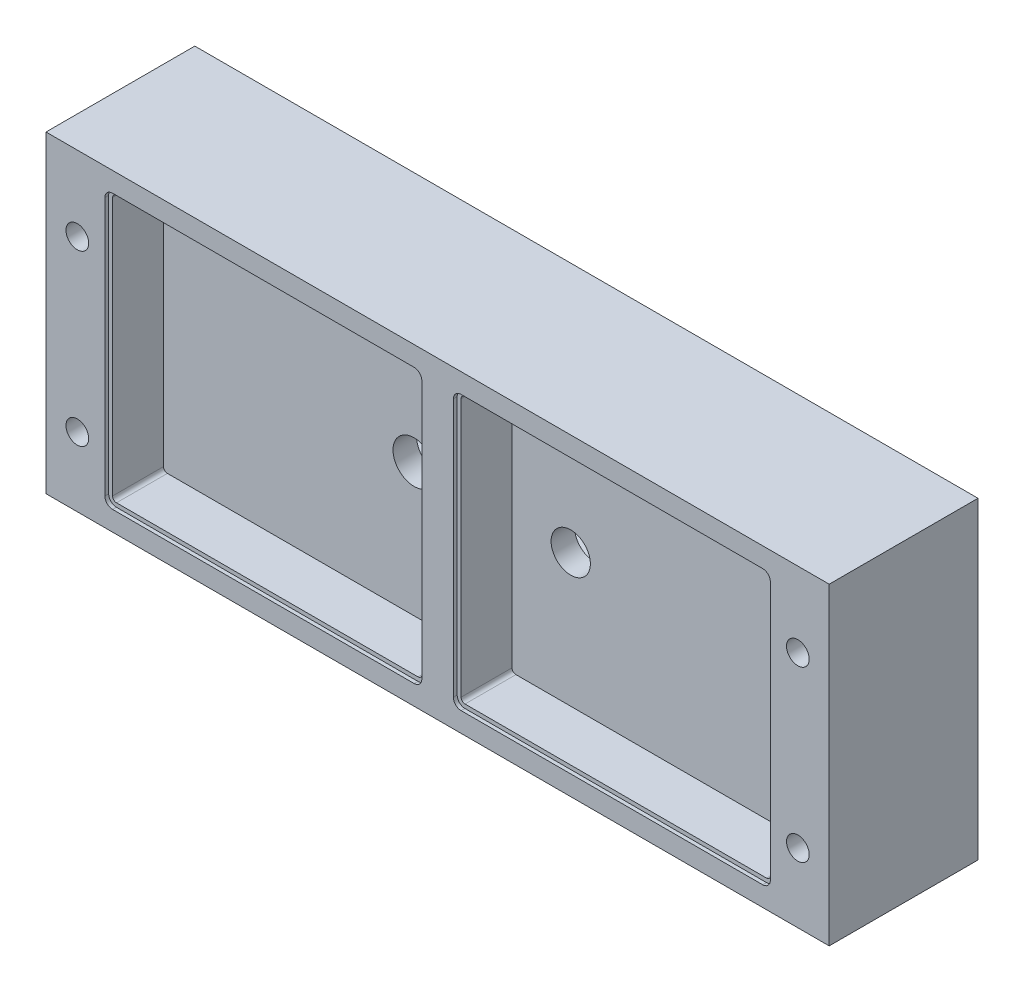
from build123d import *

# Parameters (mm, degrees)
SKETCH1_W           = 100
SKETCH1_H           = 40
BOSS_EXTRUDE1_DEPTH = 38
CUT_EXTRUDE2_START  = -12
SKETCH2_W           = 39.5
SKETCH2_H           = 34
CUT_EXTRUDE2_DEPTH  = 21
CUT_EXTRUDE4_REACH  = 81.36
SKETCH4_R           = 1.45
SKETCH6_W           = 100
SKETCH6_H           = 19
CUT_EXTRUDE5_DEPTH  = 87.215210375
FILLET1_R           = 0.5
CUT_EXTRUDE6_START  = 6.5
CUT_EXTRUDE6_DEPTH  = 0.5
CUT_EXTRUDE6_TAPER  = 2
CUT_EXTRUDE7_START  = 6.5
CUT_EXTRUDE7_DEPTH  = 0.5
CUT_EXTRUDE7_TAPER  = 2
CUT_EXTRUDE12_DEPTH = 9
CUT_EXTRUDE13_REACH = 72.385
SKETCH18_R          = 2.506862912
SKETCH18_R_2        = 2.693115416
SKETCH19_R          = 6.477
SKETCH19_R_2        = 4.572
CUT_EXTRUDE14_DEPTH = 0.79375


with BuildPart() as part:
    # Sketch1 → Boss-Extrude1 (new body)
    with BuildSketch(Plane.XY):
        with Locations((16.25, 1.5625)):
            Rectangle(SKETCH1_W, SKETCH1_H)
    extrude(amount=BOSS_EXTRUDE1_DEPTH)

    # Sketch2 → Cut-Extrude2 (cut)
    with BuildSketch(Plane(origin=(0, 0, 0), x_dir=(-1, 0, 0), z_dir=(0, 0, -1)).offset(CUT_EXTRUDE2_START)):
        with Locations((-38.5, 1.5625)):
            Rectangle(SKETCH2_W, SKETCH2_H)
        with Locations((6, 1.5625)):
            Rectangle(SKETCH2_W, SKETCH2_H)
    extrude(amount=-CUT_EXTRUDE2_DEPTH, mode=Mode.SUBTRACT)

    # Sketch4 → Cut-Extrude4 (cut, up to next)
    with BuildSketch(Plane(origin=(0, 0, 0), x_dir=(-1, 0, 0), z_dir=(0, 0, -1)), mode=Mode.PRIVATE) as cut_extrude4_sk1:
        with Locations((-62.25, 11.98479819)):
            Circle(SKETCH4_R)
    cut_extrude4_tool1 = extrude(cut_extrude4_sk1.sketch, amount=-CUT_EXTRUDE4_REACH, mode=Mode.PRIVATE) & part.part
    # Sketch4 → Cut-Extrude4 (cut, up to next)
    with BuildSketch(Plane(origin=(0, 0, 0), x_dir=(-1, 0, 0), z_dir=(0, 0, -1)), mode=Mode.PRIVATE) as cut_extrude4_sk2:
        with Locations((-62.25, -9.616561755)):
            Circle(SKETCH4_R)
    cut_extrude4_tool2 = extrude(cut_extrude4_sk2.sketch, amount=-CUT_EXTRUDE4_REACH, mode=Mode.PRIVATE) & part.part
    # Sketch4 → Cut-Extrude4 (cut, up to next)
    with BuildSketch(Plane(origin=(0, 0, 0), x_dir=(-1, 0, 0), z_dir=(0, 0, -1)), mode=Mode.PRIVATE) as cut_extrude4_sk3:
        with Locations((29.75, 11.98479819)):
            Circle(SKETCH4_R)
    cut_extrude4_tool3 = extrude(cut_extrude4_sk3.sketch, amount=-CUT_EXTRUDE4_REACH, mode=Mode.PRIVATE) & part.part
    # Sketch4 → Cut-Extrude4 (cut, up to next)
    with BuildSketch(Plane(origin=(0, 0, 0), x_dir=(-1, 0, 0), z_dir=(0, 0, -1)), mode=Mode.PRIVATE) as cut_extrude4_sk4:
        with Locations((29.75, -9.616561755)):
            Circle(SKETCH4_R)
    cut_extrude4_tool4 = extrude(cut_extrude4_sk4.sketch, amount=-CUT_EXTRUDE4_REACH, mode=Mode.PRIVATE) & part.part
    add(cut_extrude4_tool1.solids().sort_by_distance((62.25, 11.984798, 0))[0], mode=Mode.SUBTRACT)
    add(cut_extrude4_tool2.solids().sort_by_distance((62.25, -9.616562, 0))[0], mode=Mode.SUBTRACT)
    add(cut_extrude4_tool3.solids().sort_by_distance((-29.75, 11.984798, 0))[0], mode=Mode.SUBTRACT)
    add(cut_extrude4_tool4.solids().sort_by_distance((-29.75, -9.616562, 0))[0], mode=Mode.SUBTRACT)

    # Sketch6 → Cut-Extrude5 (cut, through all)
    with BuildSketch(Plane(origin=(0, 21.5625, 0), x_dir=(1, 0, 0), z_dir=(0, 1, 0))):
        with Locations((16.25, -28.5)):
            Rectangle(SKETCH6_W, SKETCH6_H)
    extrude(amount=-CUT_EXTRUDE5_DEPTH, mode=Mode.SUBTRACT)

    # Fillet1
    fillet1_edges = [part.edges().sort_by_distance(p)[0] for p in [
        (-25.75, -15.4375, 15.5),
        (13.75, -15.4375, 15.5),
        (-25.75, 18.5625, 15.5),
        (13.75, 18.5625, 15.5),
        (18.75, -15.4375, 15.5),
        (58.25, -15.4375, 15.5),
        (18.75, 18.5625, 15.5),
        (58.25, 18.5625, 15.5),
    ]]
    fillet(fillet1_edges, radius=FILLET1_R)

    # Sketch10 → Cut-Extrude6 (cut)
    with BuildSketch(Plane.XY.offset(12).offset(CUT_EXTRUDE6_START)):
        with BuildLine():
            Line((14.25, -14.9375), (14.25, 18.0625))
            ThreePointArc((14.25, 18.0625), (13.957106781, 18.769606781), (13.25, 19.0625))
            Line((13.25, 19.0625), (-25.25, 19.0625))
            ThreePointArc((-25.25, 19.0625), (-25.957106781, 18.769606781), (-26.25, 18.0625))
            Line((-26.25, 18.0625), (-26.25, -14.9375))
            ThreePointArc((-26.25, -14.9375), (-25.957106781, -15.644606781), (-25.25, -15.9375))
            Line((-25.25, -15.9375), (13.25, -15.9375))
            ThreePointArc((13.25, -15.9375), (13.957106781, -15.644606781), (14.25, -14.9375))
        make_face()
    extrude(amount=CUT_EXTRUDE6_DEPTH, taper=CUT_EXTRUDE6_TAPER, mode=Mode.SUBTRACT)

    # Sketch11 → Cut-Extrude7 (cut)
    with BuildSketch(Plane.XY.offset(12).offset(CUT_EXTRUDE7_START)):
        with BuildLine():
            Line((58.75, -14.9375), (58.75, 18.0625))
            ThreePointArc((58.75, 18.0625), (58.457106781, 18.769606781), (57.75, 19.0625))
            Line((57.75, 19.0625), (19.25, 19.0625))
            ThreePointArc((19.25, 19.0625), (18.542893219, 18.769606781), (18.25, 18.0625))
            Line((18.25, 18.0625), (18.25, -14.9375))
            ThreePointArc((18.25, -14.9375), (18.542893219, -15.644606781), (19.25, -15.9375))
            Line((19.25, -15.9375), (57.75, -15.9375))
            ThreePointArc((57.75, -15.9375), (58.457106781, -15.644606781), (58.75, -14.9375))
        make_face()
    extrude(amount=CUT_EXTRUDE7_DEPTH, taper=CUT_EXTRUDE7_TAPER, mode=Mode.SUBTRACT)

    # Sketch17 → Cut-Extrude12 (cut)
    with BuildSketch(Plane(origin=(0, 0, 0), x_dir=(-1, 0, 0), z_dir=(0, 0, -1))):
        with BuildLine():
            Line((-56.25, 9.0625), (23.75, 9.0625))
            ThreePointArc((23.75, 9.0625), (31.25, 1.5625), (23.75, -5.9375))
            Line((23.75, -5.9375), (-56.25, -5.9375))
            ThreePointArc((-56.25, -5.9375), (-63.75, 1.5625), (-56.25, 9.0625))
        make_face()
    extrude(amount=-CUT_EXTRUDE12_DEPTH, mode=Mode.SUBTRACT)

    # Sketch18 → Cut-Extrude13 (cut, up to next)
    with BuildSketch(Plane(origin=(0, 0, 9), x_dir=(-1, 0, 0), z_dir=(0, 0, -1)), mode=Mode.PRIVATE) as cut_extrude13_sk1:
        with Locations((-26.25, 1.5625)):
            Circle(SKETCH18_R)
    cut_extrude13_tool1 = extrude(cut_extrude13_sk1.sketch, amount=-CUT_EXTRUDE13_REACH, mode=Mode.PRIVATE) & part.part
    # Sketch18 → Cut-Extrude13 (cut, up to next)
    with BuildSketch(Plane(origin=(0, 0, 9), x_dir=(-1, 0, 0), z_dir=(0, 0, -1)), mode=Mode.PRIVATE) as cut_extrude13_sk2:
        with Locations((-6.25, 1.5625)):
            Circle(SKETCH18_R_2)
    cut_extrude13_tool2 = extrude(cut_extrude13_sk2.sketch, amount=-CUT_EXTRUDE13_REACH, mode=Mode.PRIVATE) & part.part
    add(cut_extrude13_tool1.solids().sort_by_distance((26.25, 1.5625, 9))[0], mode=Mode.SUBTRACT)
    add(cut_extrude13_tool2.solids().sort_by_distance((6.25, 1.5625, 9))[0], mode=Mode.SUBTRACT)

    # Sketch19 → Cut-Extrude14 (cut)
    # profile 1 of 2: a face of its own
    with BuildSketch(Plane(origin=(0, 0, 9), x_dir=(-1, 0, 0), z_dir=(0, 0, -1))):
        with Locations((-26.25, 1.5625)):
            Circle(SKETCH19_R)
        with Locations((-26.25, 1.5625)):
            Circle(SKETCH19_R_2, mode=Mode.SUBTRACT)
    # profile 2 of 2: a face of its own
    with BuildSketch(Plane(origin=(0, 0, 9), x_dir=(-1, 0, 0), z_dir=(0, 0, -1))):
        with Locations((-6.25, 1.5625)):
            Circle(SKETCH19_R)
        with Locations((-6.25, 1.5625)):
            Circle(SKETCH19_R_2, mode=Mode.SUBTRACT)
    extrude(amount=-CUT_EXTRUDE14_DEPTH, mode=Mode.SUBTRACT)


solid = part.part
